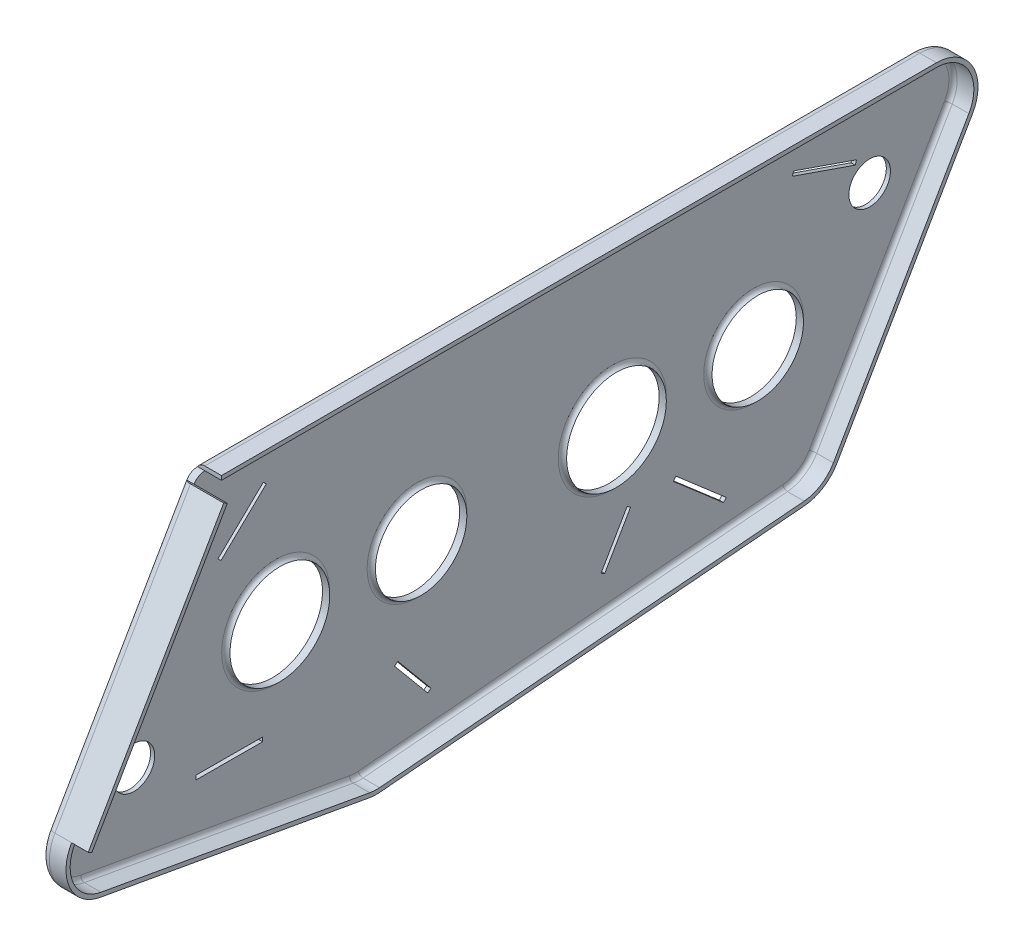
from build123d import *

# Parameters (mm, degrees)
BOSS_EXTRUDE1_DEPTH = 2.5
FILLET2_R           = 1
SKETCH5_R           = 5
SKETCH5_R_2         = 5.5
SKETCH5_R_3         = 2
CUT_EXTRUDE5_DEPTH  = 76.127410436
FILLET6_R           = 1
SHELL2_T            = -0.5
CUT_EXTRUDE6_START  = -8
SKETCH6_R           = 6
SKETCH6_R_2         = 5.5
SKETCH6_R_3         = 5
CUT_EXTRUDE6_DEPTH  = 8
CUT_EXTRUDE8_START  = -9
SKETCH9_R           = 2.5
SKETCH9_R_2         = 2
CUT_EXTRUDE8_DEPTH  = 9
SKETCH10_W          = 2
SKETCH10_H          = 2
CUT_EXTRUDE9_DEPTH  = 76.127410436
CUT_EXTRUDE10_DEPTH = 76.095790819
CUT_EXTRUDE11_DEPTH = 76.095790819


with BuildPart() as part:
    # Sketch1 → Boss-Extrude1 (new, symmetric)
    with BuildSketch(Plane(origin=(0, 0, 0), x_dir=(0, 0, -1), z_dir=(1, 0, 0))):
        with BuildLine():
            Line((-43.012595055, 0), (43.012595055, 0))
            ThreePointArc((43.012595055, 0), (47.342722074, -2.5), (47.342722074, -7.5))
            Line((47.342722074, -7.5), (31.03992852, -35.737266741))
            ThreePointArc((31.03992852, -35.737266741), (29.389703053, -37.458419151), (27.130002615, -38.219578556))
            Line((27.130002615, -38.219578556), (-23.950021044, -42.527595329))
            ThreePointArc((-23.950021044, -42.527595329), (-24.603938113, -42.539818212), (-25.253856236, -42.466583222))
            Line((-25.253856236, -42.466583222), (-57.600946475, -36.658566449))
            ThreePointArc((-57.600946475, -36.658566449), (-61.252149608, -33.843270413), (-61.047439416, -29.237266741))
            Line((-61.047439416, -29.237266741), (-44.744645862, -1))
            ThreePointArc((-44.744645862, -1), (-44.012595055, -0.267949192), (-43.012595055, 0))
        make_face()
    extrude(amount=BOSS_EXTRUDE1_DEPTH, both=True)

    # Fillet2
    fillet2_edges = [part.edges().sort_by_distance(p)[0] for p in [
        (-2.5, -39.562574835, 41.427401356),
    ]]
    fillet(fillet2_edges, radius=FILLET2_R)

    # Sketch5 → Cut-Extrude5 (cut, through all)
    with BuildSketch(Plane.ZY.offset(2.5)):
        with Locations((-23.512595055, -21)):
            Circle(SKETCH5_R)
        with Locations((-6.512595055, -21)):
            Circle(SKETCH5_R_2)
        with Locations((16.987404945, -21)):
            Circle(SKETCH5_R)
        with Locations((33.987404945, -21)):
            Circle(SKETCH5_R_2)
        with Locations((-37.47669667, -11)):
            Circle(SKETCH5_R_3)
        with Locations((51.047439416, -27.658566449)):
            Circle(SKETCH5_R_3)
    extrude(amount=-CUT_EXTRUDE5_DEPTH, mode=Mode.SUBTRACT)

    # Fillet6
    fillet6_edges = [part.edges().sort_by_distance(p)[0] for p in [
        (-2.5, -21, 28.487404945),
        (-2.5, -21, 11.987404945),
        (-2.5, -21, -12.012595055),
        (-2.5, -21, -28.512595055),
    ]]
    fillet(fillet6_edges, radius=FILLET6_R)

    # Shell2
    shell2_openings = [part.faces().sort_by_distance(p)[0] for p in [
        (2.5, -19.816827654, 7.535911422),
    ]]
    offset(amount=SHELL2_T, openings=shell2_openings, kind=Kind.INTERSECTION)

    # Sketch6 → Cut-Extrude6 (cut)
    # profile 1 of 4: a face of its own
    with BuildSketch(Plane(origin=(2.5, 0, 0), x_dir=(0, 0, -1), z_dir=(1, 0, 0)).offset(CUT_EXTRUDE6_START)):
        with Locations((-33.987404945, -21)):
            Circle(SKETCH6_R)
        with Locations((-33.987404945, -21)):
            Circle(SKETCH6_R_2, mode=Mode.SUBTRACT)
    # profile 2 of 4: a face of its own
    with BuildSketch(Plane(origin=(2.5, 0, 0), x_dir=(0, 0, -1), z_dir=(1, 0, 0)).offset(CUT_EXTRUDE6_START)):
        with Locations((-16.987404945, -21)):
            Circle(SKETCH6_R_2)
        with Locations((-16.987404945, -21)):
            Circle(SKETCH6_R_3, mode=Mode.SUBTRACT)
    # profile 3 of 4: a face of its own
    with BuildSketch(Plane(origin=(2.5, 0, 0), x_dir=(0, 0, -1), z_dir=(1, 0, 0)).offset(CUT_EXTRUDE6_START)):
        with Locations((6.512595055, -21)):
            Circle(SKETCH6_R)
        with Locations((6.512595055, -21)):
            Circle(SKETCH6_R_2, mode=Mode.SUBTRACT)
    # profile 4 of 4: a face of its own
    with BuildSketch(Plane(origin=(2.5, 0, 0), x_dir=(0, 0, -1), z_dir=(1, 0, 0)).offset(CUT_EXTRUDE6_START)):
        with Locations((23.512595055, -21)):
            Circle(SKETCH6_R_2)
        with Locations((23.512595055, -21)):
            Circle(SKETCH6_R_3, mode=Mode.SUBTRACT)
    extrude(amount=CUT_EXTRUDE6_DEPTH, mode=Mode.SUBTRACT)

    # Sketch9 → Cut-Extrude8 (cut)
    # profile 1 of 2: a face of its own
    with BuildSketch(Plane(origin=(2.5, 0, 0), x_dir=(0, 0, -1), z_dir=(1, 0, 0)).offset(CUT_EXTRUDE8_START)):
        with Locations((-51.047439416, -27.658566449)):
            Circle(SKETCH9_R)
        with Locations((-51.047439416, -27.658566449)):
            Circle(SKETCH9_R_2, mode=Mode.SUBTRACT)
    # profile 2 of 2: a face of its own
    with BuildSketch(Plane(origin=(2.5, 0, 0), x_dir=(0, 0, -1), z_dir=(1, 0, 0)).offset(CUT_EXTRUDE8_START)):
        with Locations((37.47669667, -11)):
            Circle(SKETCH9_R)
        with Locations((37.47669667, -11)):
            Circle(SKETCH9_R_2, mode=Mode.SUBTRACT)
    extrude(amount=CUT_EXTRUDE8_DEPTH, mode=Mode.SUBTRACT)

    # Cut-Sweep1: sweep along a path in Sketch11
    with BuildLine(Plane(origin=(2.5, 0, 0), x_dir=(0, 0, -1), z_dir=(1, 0, 0))) as cut_sweep1_path:
        Line((-43.012595055, 0), (43.012595055, 0))
        ThreePointArc((43.012595055, 0), (47.342722074, -2.5), (47.342722074, -7.5))
        Line((47.342722074, -7.5), (31.03992852, -35.737266741))
        ThreePointArc((31.03992852, -35.737266741), (29.389703053, -37.458419151), (27.130002615, -38.219578556))
        Line((27.130002615, -38.219578556), (-23.950021044, -42.527595329))
        ThreePointArc((-23.950021044, -42.527595329), (-24.603938113, -42.539818212), (-25.253856236, -42.466583222))
        Line((-25.253856236, -42.466583222), (-57.600946475, -36.658566449))
        ThreePointArc((-57.600946475, -36.658566449), (-61.252149608, -33.843270413), (-61.047439416, -29.237266741))
    # Sketch10 → Cut-Sweep1 (sweep, cut)
    with BuildSketch(Plane(origin=(0, -43, 43.0126), x_dir=(1, 0, 0), z_dir=(0, 0, -1))):
        with Locations((1.5, -42)):
            Rectangle(SKETCH10_W, SKETCH10_H)
    sweep(path=cut_sweep1_path.line, mode=Mode.SUBTRACT)

    # Sketch12 → Cut-Extrude9 (cut, through all)
    with BuildSketch(Plane(origin=(2.5, 0, 0), x_dir=(0, 0, -1), z_dir=(1, 0, 0))):
        with BuildLine():
            Line((-44.744645862, -1), (-44.31163316, -1.25))
            ThreePointArc((-44.31163316, -1.25), (-43.762595055, -0.700961894), (-43.012595055, -0.5))
            Line((-43.012595055, -0.5), (-43.0126, 0))
            ThreePointArc((-43.0126, 0), (-44.012597196, -0.267950429), (-44.744645862, -1))
        make_face()
    extrude(amount=-CUT_EXTRUDE9_DEPTH, mode=Mode.SUBTRACT)

    # Sketch16 → Cut-Extrude10 (cut, through all)
    with BuildSketch(Plane(origin=(-2, 0, 0), x_dir=(0, 0, -1), z_dir=(1, 0, 0))):
        Polygon((28.336733491, -5.186540954), (35.895663304, -7.806193619), (35.731935012, -8.278626732), (28.1730052, -5.658974067), align=None)
        Polygon((13.845730268, -30.285694789), (14.1730052, -29.907685373), (20.221155863, -35.144084284), (19.893880931, -35.5220937), align=None)
    extrude(amount=-CUT_EXTRUDE10_DEPTH, mode=Mode.SUBTRACT)

    # Sketch17 → Cut-Extrude11 (cut, through all)
    with BuildSketch(Plane(origin=(-2, 0, 0), x_dir=(0, 0, -1), z_dir=(1, 0, 0))):
        Polygon((-40.928557961, -10.968645678), (-40.581675856, -11.328746782), (-35.124829631, -6.07221665), (-35.471711736, -5.712115546), align=None)
        Polygon((-43.564715713, -32.68438439), (-43.562992537, -32.18438736), (-35.563040047, -32.211958171), (-35.564763223, -32.711955201), align=None)
        Polygon((-19.681480716, -32.783072797), (-19.297455371, -32.462878271), (-15.31478017, -37.239500279), (-15.698805515, -37.559694805), align=None)
        Polygon((8.285467794, -30.136573639), (8.71769663, -30.387926445), (5.591295321, -35.764117886), (5.159066484, -35.51276508), align=None)
    extrude(amount=-CUT_EXTRUDE11_DEPTH, mode=Mode.SUBTRACT)


solid = part.part
